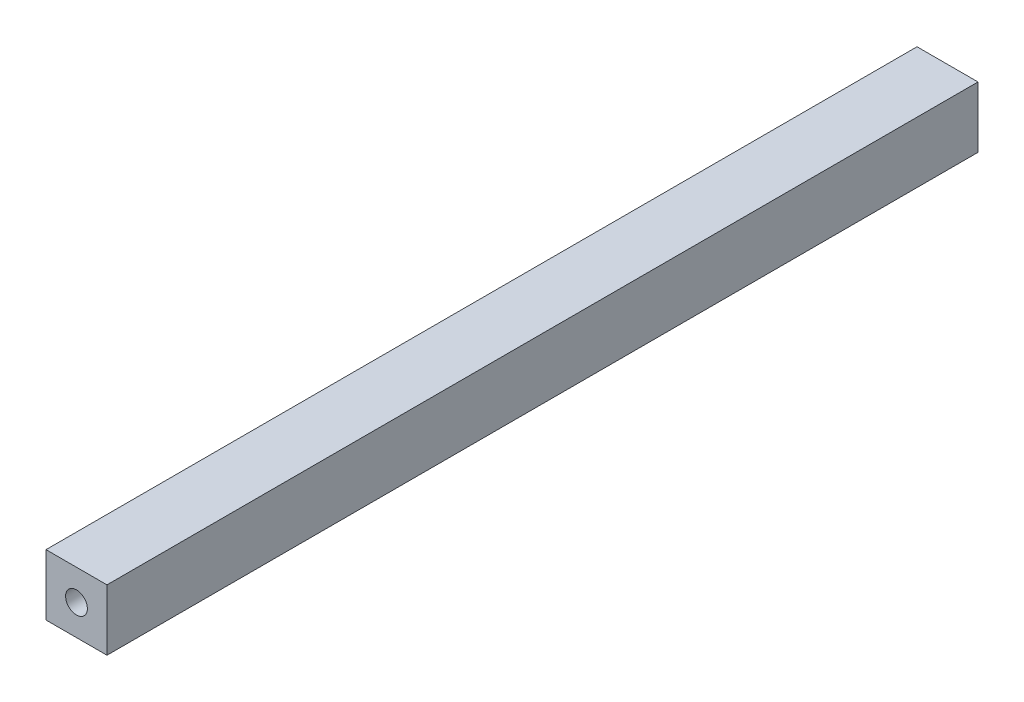
from build123d import *

# Parameters (mm, degrees)
SKETCH1_W           = 35.56
SKETCH1_H           = 35.56
BOSS_EXTRUDE1_DEPTH = 508
SKETCH2_R           = 6.35
CUT_EXTRUDE1_DEPTH  = 509.621919307


with BuildPart() as part:
    # Sketch1 → Boss-Extrude1 (new body)
    with BuildSketch(Plane.XY):
        Rectangle(SKETCH1_W, SKETCH1_H)
    extrude(amount=BOSS_EXTRUDE1_DEPTH)

    # Sketch2 → Cut-Extrude1 (cut, through all)
    with BuildSketch(Plane.XY.offset(508)):
        Circle(SKETCH2_R)
    extrude(amount=-CUT_EXTRUDE1_DEPTH, mode=Mode.SUBTRACT)


solid = part.part
